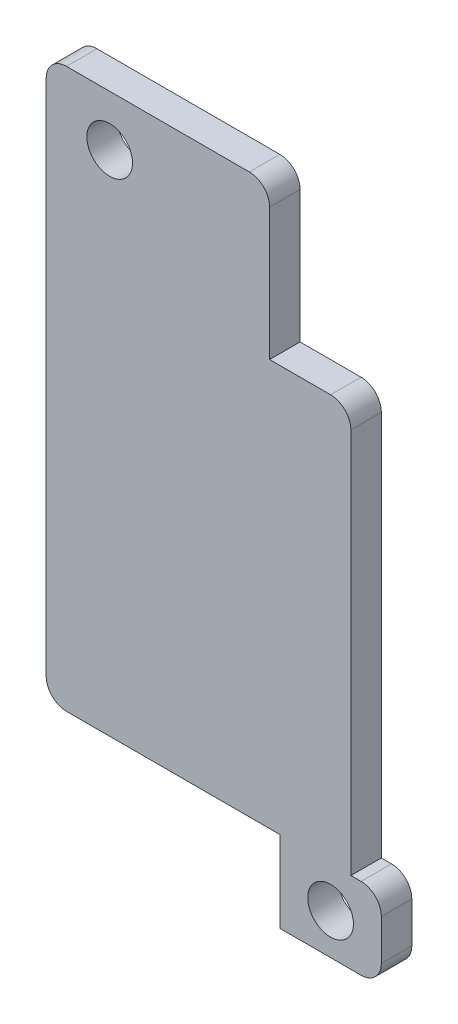
from build123d import *

# Parameters (mm, degrees)
SKETCH1_W            = 30
SKETCH1_H            = 55
BOSS_EXTRUDE1_DEPTH  = 1.5
SKETCH2_W            = 8
SKETCH2_H            = 15
CUT_EXTRUDE1_DEPTH   = 43.238610108
SKETCH3_W            = 7
SKETCH3_H            = 3
BOSS_EXTRUDE2_DEPTH  = 8
SKETCH6_W            = 3
SKETCH6_H            = 8
BOSS_EXTRUDE3_DEPTH  = 3
M4_CLEARANCE_HOLE1_D = 4.5
FILLET1_R            = 2


with BuildPart() as part:
    # Sketch1 → Boss-Extrude1 (new, symmetric)
    with BuildSketch(Plane.XY):
        with Locations((0.944117647, -11.498529412)):
            Rectangle(SKETCH1_W, SKETCH1_H)
    extrude(amount=BOSS_EXTRUDE1_DEPTH, both=True)

    # Sketch2 → Cut-Extrude1 (cut, through all)
    with BuildSketch(Plane.XY.offset(1.5)):
        with Locations((11.944117647, 8.501470588)):
            Rectangle(SKETCH2_W, SKETCH2_H)
    extrude(amount=-CUT_EXTRUDE1_DEPTH, mode=Mode.SUBTRACT)

    # Sketch3 → Boss-Extrude2 (add)
    with BuildSketch(Plane(origin=(0, -38.998529412, 0), x_dir=(-1, 0, 0), z_dir=(0, -1, 0))):
        with Locations((-12.444117647, 0)):
            Rectangle(SKETCH3_W, SKETCH3_H)
    extrude(amount=BOSS_EXTRUDE2_DEPTH)

    # Sketch6 → Boss-Extrude3 (add)
    with BuildSketch(Plane(origin=(15.944117647, 0, 0), x_dir=(0, 0, -1), z_dir=(1, 0, 0))):
        with Locations((0, -42.998529412)):
            Rectangle(SKETCH6_W, SKETCH6_H)
    extrude(amount=BOSS_EXTRUDE3_DEPTH)

    # M4 Clearance Hole1 (through all)
    with Locations(Plane.XY.offset(1.5)):
        with Locations((-7.805882353, 11.001470588), (13.944117647, -42.998529412)):
            Hole(M4_CLEARANCE_HOLE1_D / 2)

    # Fillet1
    fillet1_edges = [part.edges().sort_by_distance(p)[0] for p in [
        (7.944117647, 16.001470588, 0),
        (15.944117647, 1.001470588, 0),
        (18.944117647, -46.998529412, 0),
        (18.944117647, -38.998529412, 0),
        (-14.055882353, 16.001470588, 0),
        (-14.055882353, -38.998529412, 0),
    ]]
    fillet(fillet1_edges, radius=FILLET1_R)


solid = part.part
